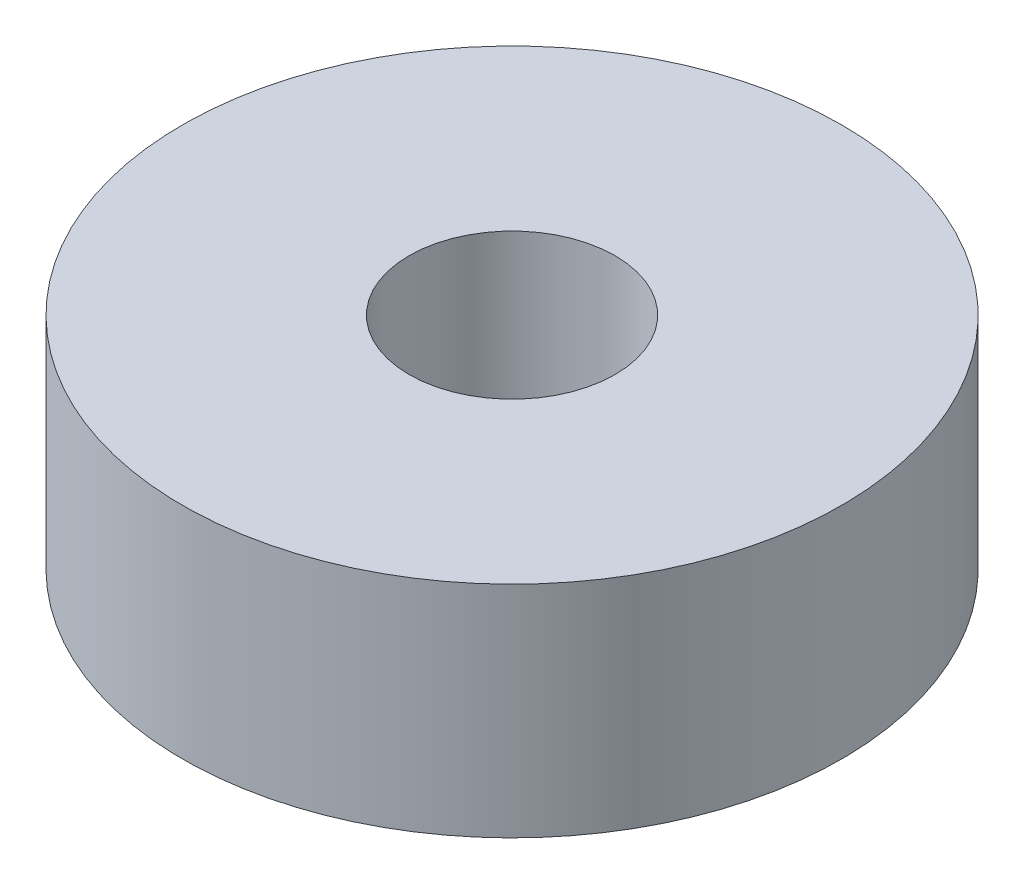
from build123d import *


with BuildPart() as part:
    # Sketch1 → Revolve1 (revolve)
    with BuildSketch(Plane.XY, mode=Mode.PRIVATE) as revolve1_sk:
        Polygon((-9.525, 0), (-9.525, 6.35), (-2.9765625, 6.35), (-2.9765625, 1.5875), (-1.5875, 1.5875), (-1.5875, 0), align=None)
    revolve(revolve1_sk.sketch.rotate(Axis((0, 0, 0), (0, 1, 0)), 270), axis=Axis((0, 0, 0), (0, 1, 0)))


solid = part.part
